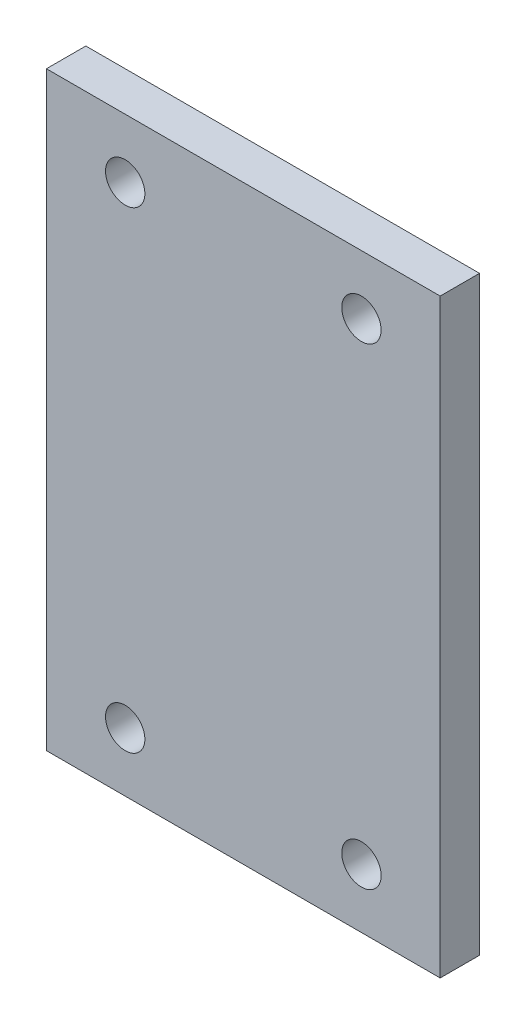
from build123d import *

# Parameters (mm, degrees)
SKETCH1_W           = 50.8
SKETCH1_H           = 76.2
SKETCH1_R           = 2.54
BOSS_EXTRUDE1_DEPTH = 5.08
SKETCH2_R           = 2.1
CUT_EXTRUDE1_DEPTH  = 4


with BuildPart() as part:
    # Sketch1 → Boss-Extrude1 (new body)
    with BuildSketch(Plane.XY):
        with Locations((-23.244105975, 56.042212855)):
            Rectangle(SKETCH1_W, SKETCH1_H)
        with Locations((-38.484105975, 25.562212855)):
            Circle(SKETCH1_R, mode=Mode.SUBTRACT)
        with Locations(Location((-8.004105975, 25.562212855, 0), (0, 0, 180))):
            Circle(SKETCH1_R, mode=Mode.SUBTRACT)
        with Locations((-8.004105975, 86.522212855)):
            Circle(SKETCH1_R, mode=Mode.SUBTRACT)
        with Locations(Location((-38.484105975, 86.522212855, 0), (0, 0, 180))):
            Circle(SKETCH1_R, mode=Mode.SUBTRACT)
    extrude(amount=BOSS_EXTRUDE1_DEPTH)

    # Sketch2 → Cut-Extrude1 (cut)
    with BuildSketch(Plane.XZ.offset(-17.942212855)):
        with Locations(Location((-38.438159235, 2.54, 0), (0, 0, 270))):
            Circle(SKETCH2_R)
        with Locations(Location((-8.050052715, 2.54, 0), (0, 0, 90))):
            Circle(SKETCH2_R)
    extrude(amount=-CUT_EXTRUDE1_DEPTH, mode=Mode.SUBTRACT)


solid = part.part
